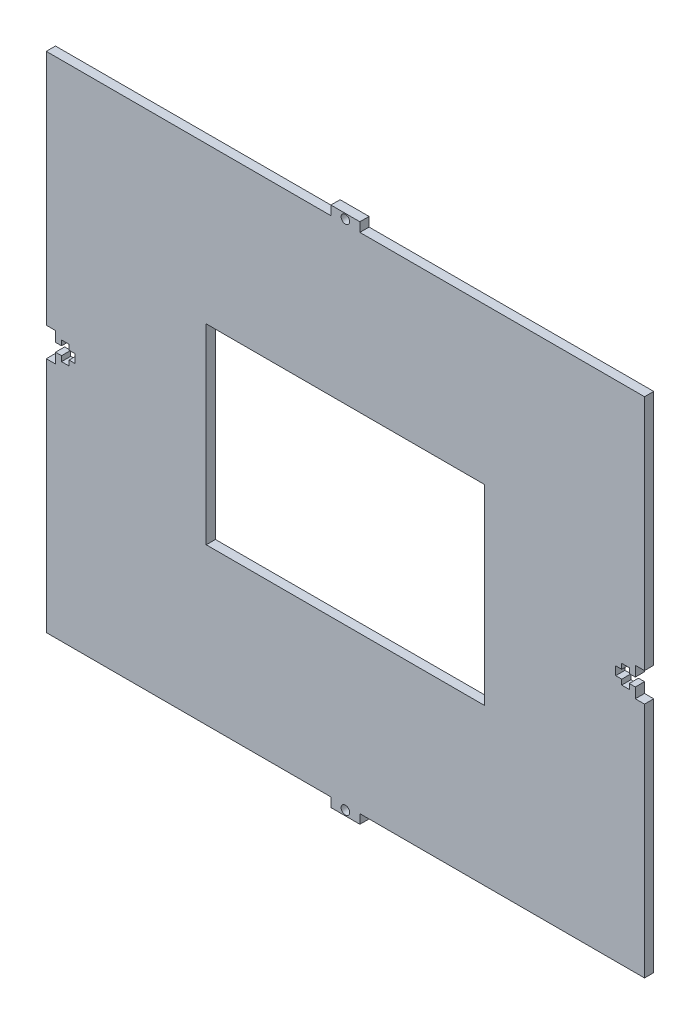
from build123d import *

# Parameters (mm, degrees)
SKETCH2_W           = 206.36
SKETCH2_H           = 173.64
BOSS_EXTRUDE1_DEPTH = 3.18
CUT_EXTRUDE1_DEPTH  = 135.884903529
SKETCH9_W           = 10
SKETCH9_H           = 3.18
BOSS_EXTRUDE4_DEPTH = 3.18
SKETCH11_R          = 1.47
CUT_EXTRUDE3_DEPTH  = 137.953367246
SKETCH12_W          = 96
SKETCH12_H          = 66
CUT_EXTRUDE4_DEPTH  = 137.953367246


with BuildPart() as part:
    # Sketch2 → Boss-Extrude1 (new body)
    with BuildSketch(Plane.XY):
        Rectangle(SKETCH2_W, SKETCH2_H)
    extrude(amount=BOSS_EXTRUDE1_DEPTH)

    # Sketch3 → Cut-Extrude1 (cut, through all)
    with BuildSketch(Plane.XY.offset(3.18)):
        Polygon((-95.32, -1.47), (-95.32, -3.25), (-97.92, -3.25), (-97.92, -1.47), (-100, -1.47), (-100, -5), (-103.18, -5), (-103.18, 5), (-100, 5), (-100, 1.47), (-97.92, 1.47), (-97.92, 3.25), (-95.32, 3.25), (-95.32, 1.47), (-93.25, 1.47), (-93.25, -1.47), align=None)
    cut_extrude1 = extrude(amount=-CUT_EXTRUDE1_DEPTH, mode=Mode.SUBTRACT)

    # Sketch9 → Boss-Extrude4 (add)
    with BuildSketch(Plane(origin=(0, 86.82, 0), x_dir=(1, 0, 0), z_dir=(0, 1, 0))):
        with Locations((0, -1.59)):
            Rectangle(SKETCH9_W, SKETCH9_H)
    boss_extrude4 = extrude(amount=BOSS_EXTRUDE4_DEPTH)

    # Sketch11 → Cut-Extrude3 (cut, through all)
    with BuildSketch(Plane.XY.offset(3.18)):
        with Locations((0, 88.25)):
            Circle(SKETCH11_R)
    cut_extrude3 = extrude(amount=-CUT_EXTRUDE3_DEPTH, mode=Mode.SUBTRACT)

    # Mirror1: Cut-Extrude1 across plane
    add(cut_extrude1.mirror(Plane(origin=(0, 0, 0), x_dir=(0, 0, 1), z_dir=(1, 0, 0))), mode=Mode.SUBTRACT)

    # Mirror2: Boss-Extrude4, Cut-Extrude3 across plane
    add(boss_extrude4.mirror(Plane.ZX))
    add(cut_extrude3.mirror(Plane.ZX), mode=Mode.SUBTRACT)

    # Sketch12 → Cut-Extrude4 (cut, through all)
    with BuildSketch(Plane.XY.offset(3.18)):
        Rectangle(SKETCH12_W, SKETCH12_H)
    extrude(amount=-CUT_EXTRUDE4_DEPTH, mode=Mode.SUBTRACT)


solid = part.part
